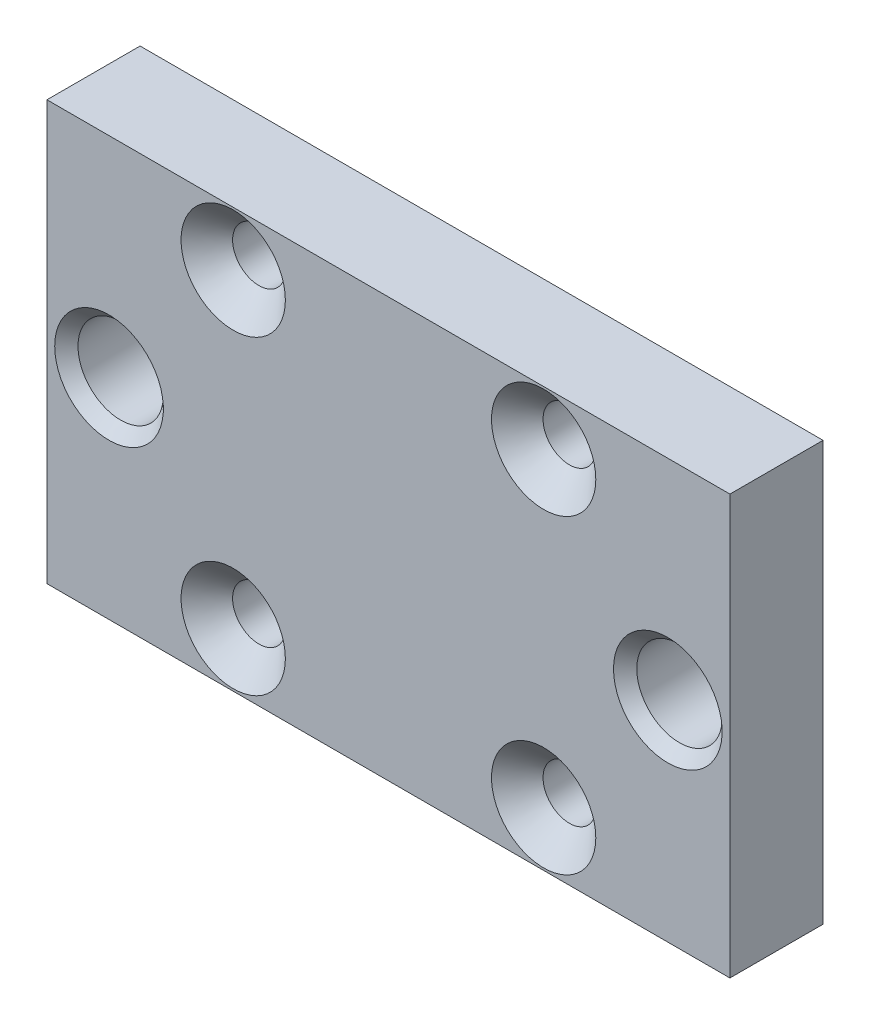
from build123d import *

# Parameters (mm, degrees)
SKETCH1_W                     = 44
SKETCH1_H                     = 27
SKETCH1_R                     = 2.75
BOSS_EXTRUDE1_DEPTH           = 6
CSK_FOR_M3_SFHCS1_D           = 3.4
CSK_FOR_M3_SFHCS1_CSINK_D     = 6.72
CSK_FOR_M3_SFHCS1_CSINK_ANGLE = 90
CHAMFER1_SIZE                 = 0.75


with BuildPart() as part:
    # Sketch1 → Boss-Extrude1 (new body)
    with BuildSketch(Plane.XY):
        Rectangle(SKETCH1_W, SKETCH1_H)
        with Locations((-18, 0)):
            Circle(SKETCH1_R, mode=Mode.SUBTRACT)
        with Locations((18, 0)):
            Circle(SKETCH1_R, mode=Mode.SUBTRACT)
    extrude(amount=BOSS_EXTRUDE1_DEPTH)

    # CSK for M3 SFHCS1 (through all)
    with Locations(Plane.XY.offset(6)):
        with Locations((-10, 10), (10, 10), (10, -10), (-10, -10)):
            CounterSinkHole(CSK_FOR_M3_SFHCS1_D / 2, CSK_FOR_M3_SFHCS1_CSINK_D / 2, counter_sink_angle=CSK_FOR_M3_SFHCS1_CSINK_ANGLE)

    # Chamfer1
    chamfer1_edges = [part.edges().sort_by_distance(p)[0] for p in [
        (-20.75, 0, 6),
        (15.25, 0, 6),
    ]]
    chamfer(chamfer1_edges, length=CHAMFER1_SIZE)


solid = part.part
